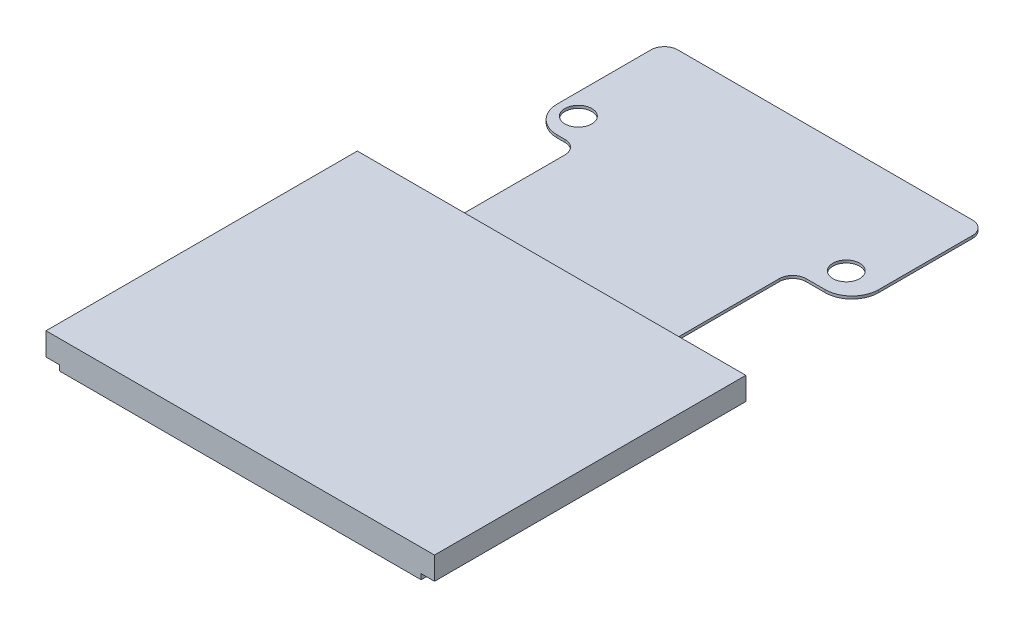
from build123d import *

# Parameters (mm, degrees)
SKETCH2_W           = 14.5
SKETCH2_H           = 11.62
BOSS_EXTRUDE1_DEPTH = 0.425
SKETCH6_W           = 13.5
SKETCH6_H           = 8.1
BOSS_EXTRUDE2_DEPTH = 0.2
SKETCH7_W           = 12.58
SKETCH7_H           = 6.98
BOSS_EXTRUDE3_DEPTH = 0.15
BOSS_EXTRUDE4_DEPTH = 0.17547
FILLET1_R           = 0.762
FILLET2_R           = 0.2
SKETCH13_W          = 8
SKETCH13_H          = 0.1
BOSS_EXTRUDE5_DEPTH = 10
SKETCH20_W          = 1.79
SKETCH20_H          = 5
SKETCH20_W_2        = 2.21
BOSS_EXTRUDE6_DEPTH = 0.1
SKETCH23_R          = 0.5
CUT_EXTRUDE1_DEPTH  = 0.1
FILLET3_R           = 1
FILLET4_R           = 0.5
FILLET5_R           = 0.5


with BuildPart() as part:
    # Sketch2 → Boss-Extrude1 (new, symmetric)
    with BuildSketch(Plane(origin=(0, 0, 0), x_dir=(1, 0, 0), z_dir=(0, 1, 0))):
        Rectangle(SKETCH2_W, SKETCH2_H)
    extrude(amount=BOSS_EXTRUDE1_DEPTH, both=True)

    # Sketch6 → Boss-Extrude2 (add)
    with BuildSketch(Plane.XZ.offset(0.425)):
        with Locations((0, 1.76)):
            Rectangle(SKETCH6_W, SKETCH6_H)
    extrude(amount=BOSS_EXTRUDE2_DEPTH)

    # Sketch7 → Boss-Extrude3 (add)
    with BuildSketch(Plane.XZ.offset(0.625)):
        with Locations((0, 1.51)):
            Rectangle(SKETCH7_W, SKETCH7_H)
    extrude(amount=BOSS_EXTRUDE3_DEPTH)

    # Sketch9 → Boss-Extrude4 (add)
    with BuildSketch(Plane.XZ.offset(0.425)):
        Polygon((-6.096, -2.452696), (6.096, -2.452696), (6.096, -4.992696), (3.2893, -4.992696), (3.2893, -7.856286), (-3.2893, -7.856286), (-3.2893, -4.992696), (-6.096, -4.992696), align=None)
    extrude(amount=BOSS_EXTRUDE4_DEPTH)

    # Fillet1
    fillet1_edges = [part.edges().sort_by_distance(p)[0] for p in [
        (6.096, -0.512735, -4.992696),
        (-6.096, -0.512735, -4.992696),
    ]]
    fillet(fillet1_edges, radius=FILLET1_R)

    # Fillet2
    fillet2_edges = [part.edges().sort_by_distance(p)[0] for p in [
        (-3.2893, -0.512735, -7.856286),
        (3.2893, -0.512735, -7.856286),
    ]]
    fillet(fillet2_edges, radius=FILLET2_R)

    # Sketch13 → Boss-Extrude5 (add)
    with BuildSketch(Plane(origin=(0, 0, -5.81), x_dir=(-1, 0, 0), z_dir=(0, 0, -1))):
        with Locations((0, -0.375)):
            Rectangle(SKETCH13_W, SKETCH13_H)
    extrude(amount=BOSS_EXTRUDE5_DEPTH)

    # Sketch20 → Boss-Extrude6 (add)
    with BuildSketch(Plane.XZ.offset(0.425)):
        with Locations((-4.895, -13.31)):
            Rectangle(SKETCH20_W, SKETCH20_H)
        with Locations((5.105, -13.31)):
            Rectangle(SKETCH20_W_2, SKETCH20_H)
    extrude(amount=-BOSS_EXTRUDE6_DEPTH)

    # Sketch23 → Cut-Extrude1 (cut)
    with BuildSketch(Plane(origin=(0, -0.325, 0), x_dir=(1, 0, 0), z_dir=(0, 1, 0))):
        with Locations(Location((5, 11.81, 0), (0, 0, 270))):
            Circle(SKETCH23_R)
        with Locations(Location((-5, 11.81, 0), (0, 0, 270))):
            Circle(SKETCH23_R)
    extrude(amount=-CUT_EXTRUDE1_DEPTH, mode=Mode.SUBTRACT)

    # Fillet3
    fillet3_edges = [part.edges().sort_by_distance(p)[0] for p in [
        (-5.79, -0.375, -10.81),
        (6.21, -0.375, -10.81),
    ]]
    fillet(fillet3_edges, radius=FILLET3_R)

    # Fillet4
    fillet4_edges = [part.edges().sort_by_distance(p)[0] for p in [
        (-5.79, -0.375, -15.81),
        (6.21, -0.375, -15.81),
    ]]
    fillet(fillet4_edges, radius=FILLET4_R)

    # Fillet5
    fillet5_edges = [part.edges().sort_by_distance(p)[0] for p in [
        (-4, -0.375, -10.81),
        (4, -0.375, -10.81),
    ]]
    fillet(fillet5_edges, radius=FILLET5_R)


solid = part.part
